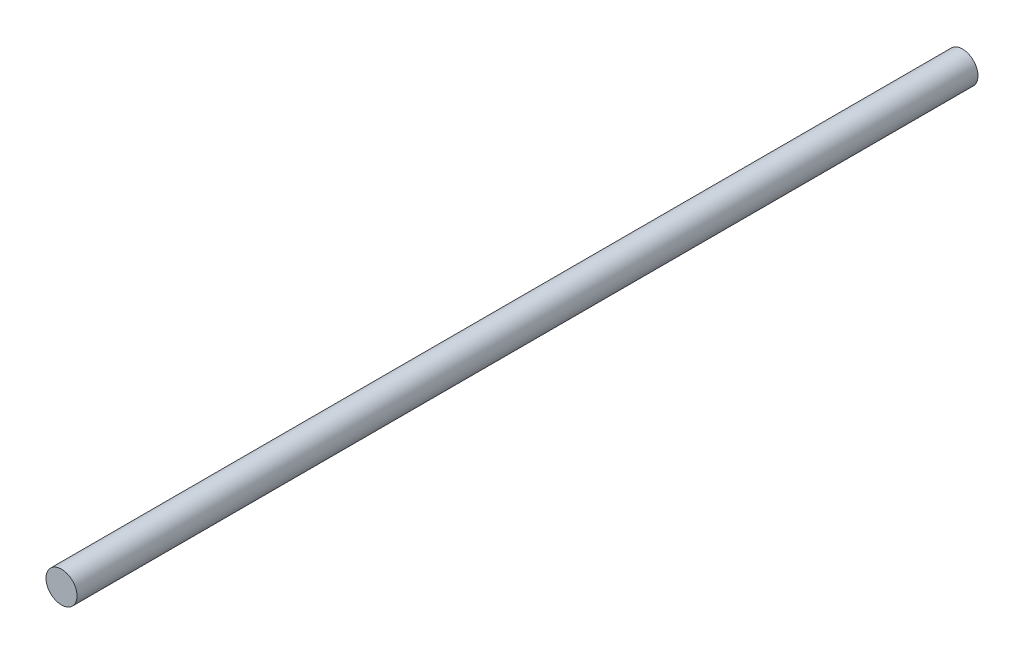
from build123d import *

# Parameters (mm, degrees)
SKETCH_1_R      = 5
EXTRUDE_1_DEPTH = 290


with BuildPart() as part:
    # 스케치1 → 보스-돌출1 (new body)
    with BuildSketch(Plane.XY):
        Circle(SKETCH_1_R)
    extrude(amount=EXTRUDE_1_DEPTH)


solid = part.part
